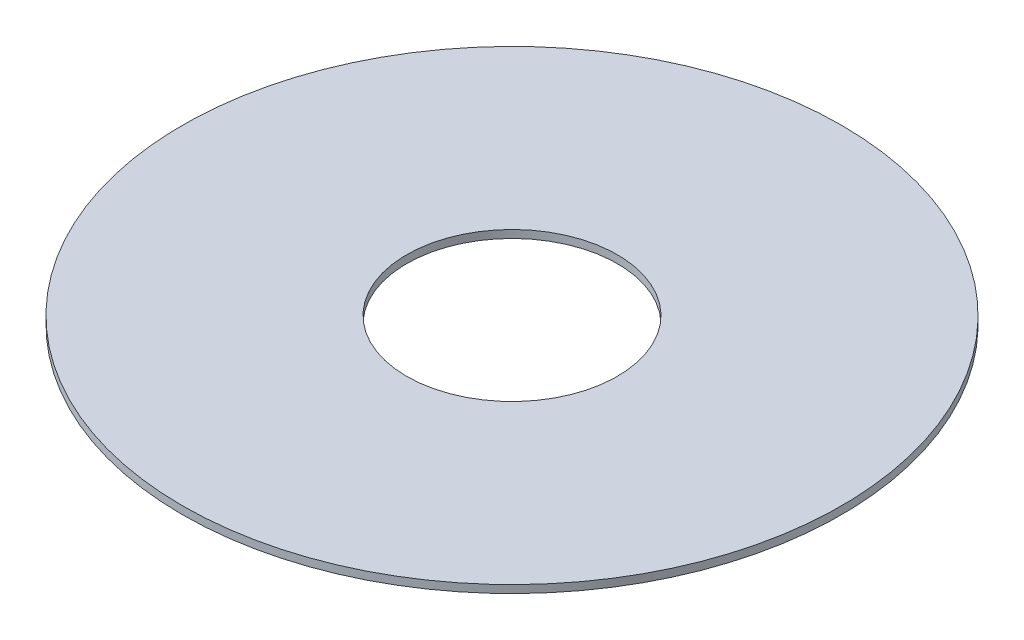
from build123d import *

# Parameters (mm, degrees)
SKETCH1_R           = 16.92
SKETCH1_R_2         = 5.4101
BOSS_EXTRUDE1_DEPTH = 0.4


with BuildPart() as part:
    # Sketch1 → Boss-Extrude1 (new body)
    with BuildSketch(Plane(origin=(0, 0, 0), x_dir=(1, 0, 0), z_dir=(0, 1, 0))):
        with Locations(Location((0, 0, 0), (0, 0, 270))):
            Circle(SKETCH1_R)
        with Locations(Location((0, 0, 0), (0, 0, 270))):
            Circle(SKETCH1_R_2, mode=Mode.SUBTRACT)
    extrude(amount=BOSS_EXTRUDE1_DEPTH)


solid = part.part
